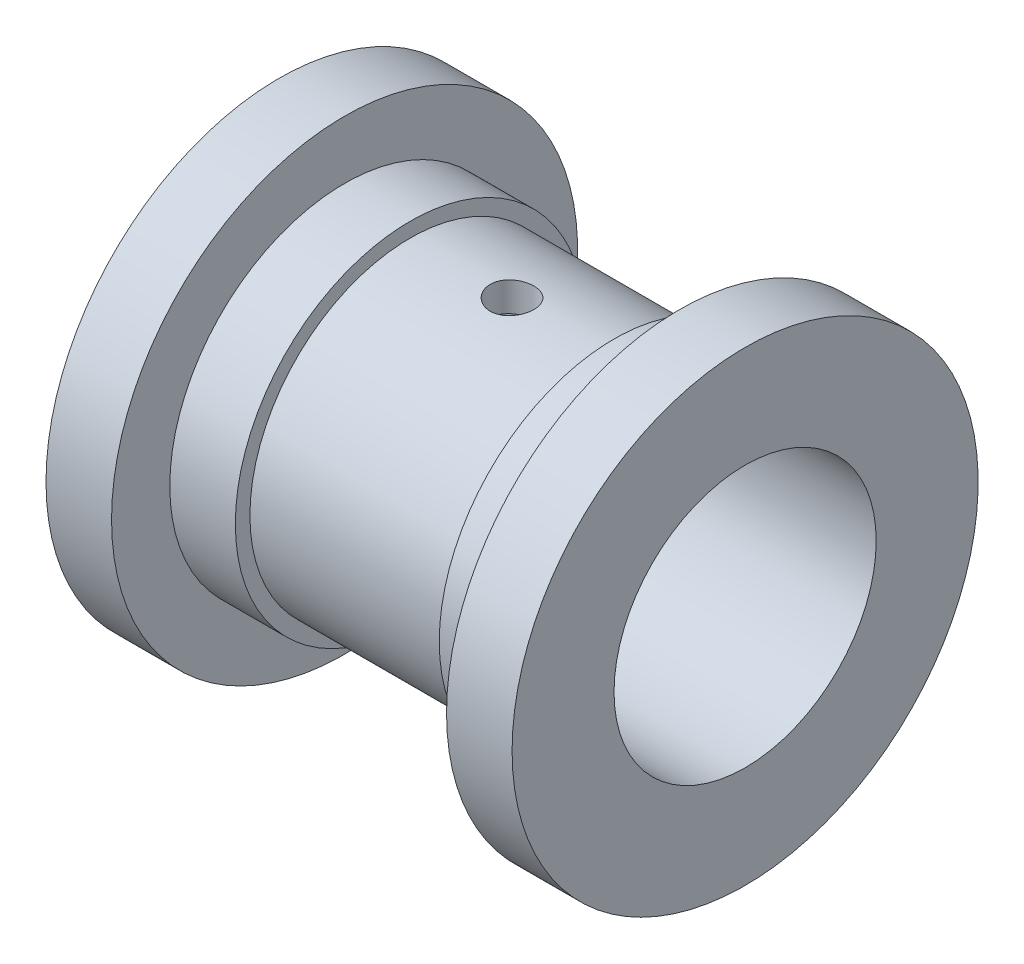
from build123d import *

# Parameters (mm, degrees)
BOSS_EXTRUDE1_REACH      = 78.759
BOSS_EXTRUDE1_END_RADIUS = 22
SKETCH2_R                = 4
SKETCH2_R_2              = 3
SKETCH3_R                = 3
CUT_EXTRUDE1_DEPTH       = 77.75936425


with BuildPart() as part:
    # Sketch1 → Revolve1 (revolve)
    with BuildSketch(Plane.XY, mode=Mode.PRIVATE) as revolve1_sk:
        Polygon((-32, 18), (-32, 32), (-23, 32), (-23, 24), (-14, 24), (-14, 22), (14, 22), (14, 24), (23, 24), (23, 32), (32, 32), (32, 18), align=None)
    revolve(revolve1_sk.sketch.rotate(Axis((-55.697732997, 0, 0), (1, 0, 0)), 90), axis=Axis((-55.697732997, 0, 0), (1, 0, 0)))

    # Boss-Extrude1: up to this cylinder (the profile starts outside it)
    boss_extrude1_end = Plane(origin=(0, 0, 0), z_dir=(-1, 0, 0)) * Cylinder(BOSS_EXTRUDE1_END_RADIUS, 202.518, mode=Mode.PRIVATE)
    # Sketch2 → Boss-Extrude1 (add, up to the surface)
    with BuildSketch(Plane(origin=(0, -30, 0), x_dir=(1, 0, 0), z_dir=(0, 1, 0)), mode=Mode.PRIVATE) as boss_extrude1_sk1:
        with Locations(Location((0, 0, 0), (0, 0, 90))):
            Circle(SKETCH2_R)
        with Locations(Location((0, 0, 0), (0, 0, 90))):
            Circle(SKETCH2_R_2, mode=Mode.SUBTRACT)
    boss_extrude1_tool1 = extrude(boss_extrude1_sk1.sketch, amount=BOSS_EXTRUDE1_REACH, mode=Mode.PRIVATE) - boss_extrude1_end
    add(boss_extrude1_tool1.solids().sort_by_distance((0, -30, 3.886863))[0])

    # Sketch3 → Cut-Extrude1 (cut, through all)
    with BuildSketch(Plane.XZ.offset(30)):
        with Locations(Location((0, 0, 0), (0, 0, 270))):
            Circle(SKETCH3_R)
    extrude(amount=-CUT_EXTRUDE1_DEPTH, mode=Mode.SUBTRACT)


solid = part.part
